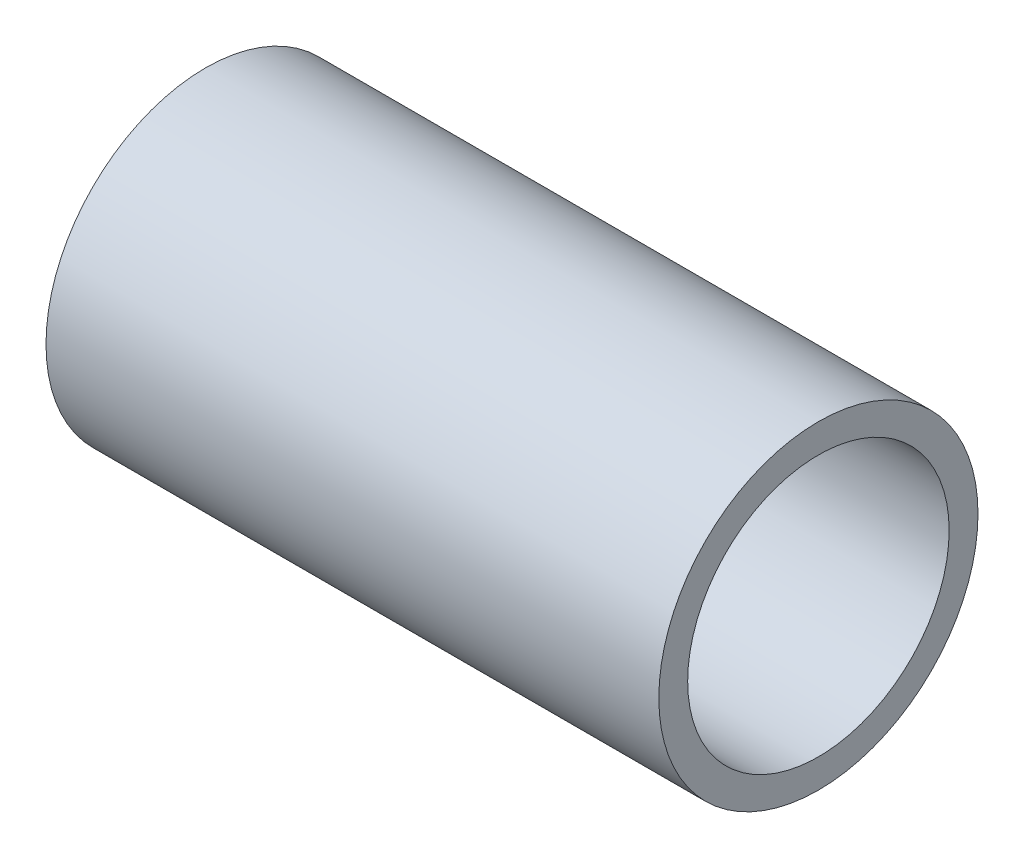
from build123d import *

# Parameters (mm, degrees)
SKETCH1_R           = 1.984375
SKETCH1_R_2         = 1.6256
BOSS_EXTRUDE1_DEPTH = 7.62


with BuildPart() as part:
    # Sketch1 → Boss-Extrude1 (new body)
    with BuildSketch(Plane(origin=(0, 0, 0), x_dir=(0, 0, -1), z_dir=(1, 0, 0))):
        with Locations(Location((0, 0, 0), (0, 0, 180))):
            Circle(SKETCH1_R)
        with Locations(Location((0, 0, 0), (0, 0, 180))):
            Circle(SKETCH1_R_2, mode=Mode.SUBTRACT)
    extrude(amount=BOSS_EXTRUDE1_DEPTH)


solid = part.part
